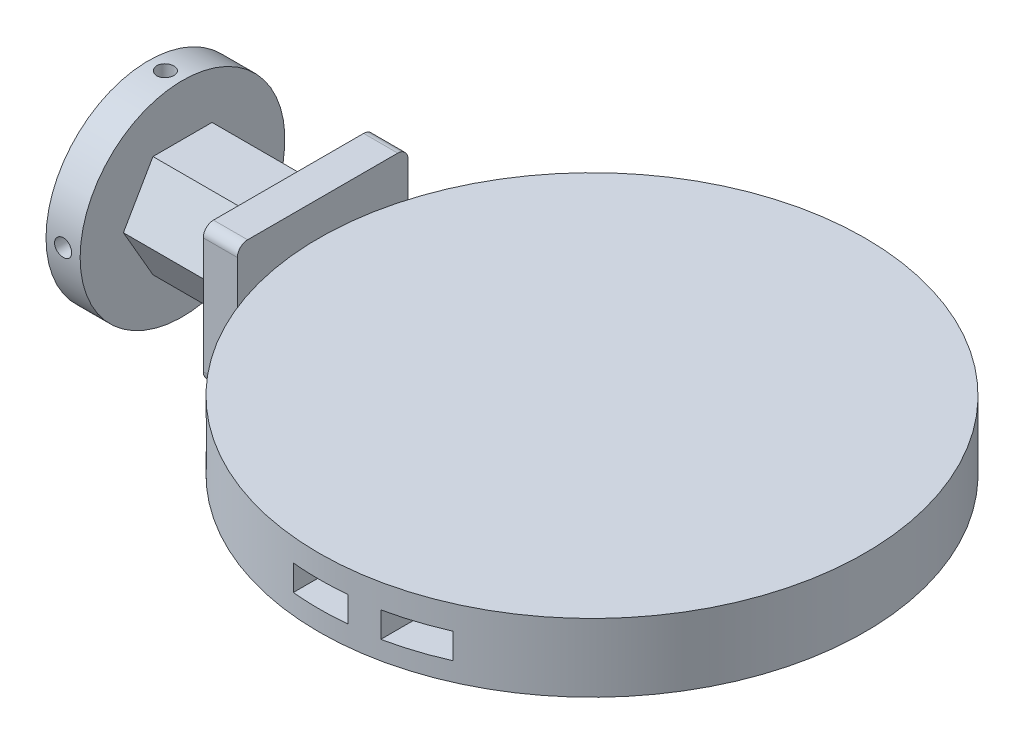
from build123d import *

# Parameters (mm, degrees)
SKETCH2_R               = 203.2
BOSS_EXTRUDE1_DEPTH     = 50.8
SKETCH6_W               = 127
SKETCH6_H               = 101.6
BOSS_EXTRUDE4_DEPTH     = 25.4
BOSS_EXTRUDE5_DEPTH     = 76.2
SKETCH8_R               = 76.2
BOSS_EXTRUDE6_DEPTH     = 25.4
CUT_EXTRUDE1_DEPTH      = 401.805239487
CUT_EXTRUDE1_DEPTH_BACK = 401.805239487
SKETCH9_R               = 6.35
CUT_EXTRUDE2_DEPTH      = 401.805239594
CUT_EXTRUDE2_DEPTH_BACK = 401.805239594
SKETCH10_R              = 6.35
FILLET1_R               = 7.62
FILLET2_R               = 7.62
FILLET3_R               = 7.62
FILLET4_R               = 7.62
SKETCH11_W              = 19.05
SKETCH11_H              = 33.02
CUT_EXTRUDE3_DEPTH      = 119.38
CUT_EXTRUDE4_DEPTH      = 401.805239594
CUT_EXTRUDE4_DEPTH_BACK = 401.805239594
SKETCH12_W              = 40.64
SKETCH12_H              = 19.05


with BuildPart() as part:
    # Sketch2 → Boss-Extrude1 (new body)
    with BuildSketch(Plane(origin=(0, 0, 0), x_dir=(1, 0, 0), z_dir=(0, 1, 0))):
        with Locations(Location((0, 0, 0), (0, 0, 270))):
            Circle(SKETCH2_R)
    extrude(amount=BOSS_EXTRUDE1_DEPTH)

    # Sketch11 → Cut-Extrude3 (cut)
    with BuildSketch(Plane(origin=(-203.2, 0, 0), x_dir=(0, 0, -1), z_dir=(1, 0, 0))):
        with Locations((140.335, 25.4)):
            Rectangle(SKETCH11_W, SKETCH11_H)
        with Locations((118.745, 25.4)):
            Rectangle(SKETCH11_W, SKETCH11_H)
        with Locations((97.155, 25.4)):
            Rectangle(SKETCH11_W, SKETCH11_H)
        with Locations((-118.745, 25.4)):
            Rectangle(SKETCH11_W, SKETCH11_H)
        with Locations((-97.155, 25.4)):
            Rectangle(SKETCH11_W, SKETCH11_H)
        with Locations((-140.335, 25.4)):
            Rectangle(SKETCH11_W, SKETCH11_H)
    extrude(amount=CUT_EXTRUDE3_DEPTH, mode=Mode.SUBTRACT)

    # Sketch12 → Cut-Extrude4 (cut, two sides: drawn at the far end of the back side and taken through both)
    with BuildSketch(Plane.XY.offset(-CUT_EXTRUDE4_DEPTH_BACK)):
        with Locations((0.245955967, 24.477312463)):
            Rectangle(SKETCH12_W, SKETCH12_H)
        with Locations((61.975563372, 23.455854612)):
            Rectangle(SKETCH12_W, SKETCH12_H)
    extrude(amount=CUT_EXTRUDE4_DEPTH + CUT_EXTRUDE4_DEPTH_BACK, mode=Mode.SUBTRACT)


with BuildPart() as body_2:
    # Sketch6 → Boss-Extrude4 (new body)
    with BuildSketch(Plane(origin=(-203.2, 0, 0), x_dir=(0, 0, -1), z_dir=(1, 0, 0))):
        with Locations((2.752969814, 25.4)):
            Rectangle(SKETCH6_W, SKETCH6_H)
    extrude(amount=-BOSS_EXTRUDE4_DEPTH)

    # Sketch7 → Boss-Extrude5 (add)
    with BuildSketch(Plane(origin=(-228.6, 0, 0), x_dir=(0, 0, -1), z_dir=(1, 0, 0))):
        Polygon((-43.994090512, 25.4), (-21.997045256, -12.7), (21.997045256, -12.7), (43.994090512, 25.4), (21.997045256, 63.5), (-21.997045256, 63.5), align=None)
    extrude(amount=-BOSS_EXTRUDE5_DEPTH)

    # Sketch8 → Boss-Extrude6 (add)
    with BuildSketch(Plane.ZY.offset(304.8)):
        with Locations((0, 25.4)):
            Circle(SKETCH8_R)
    extrude(amount=BOSS_EXTRUDE6_DEPTH)

    # Sketch9 → Cut-Extrude1 (cut, two sides: drawn at the far end of the back side and taken through both)
    with BuildSketch(Plane.XY.offset(-CUT_EXTRUDE1_DEPTH_BACK)):
        with Locations(Location((-317.5, 25.4, 0), (0, 0, 180))):
            Circle(SKETCH9_R)
    extrude(amount=CUT_EXTRUDE1_DEPTH + CUT_EXTRUDE1_DEPTH_BACK, mode=Mode.SUBTRACT)

    # Sketch10 → Cut-Extrude2 (cut, two sides: drawn at the far end of the back side and taken through both)
    with BuildSketch(Plane(origin=(0, 0, 0), x_dir=(1, 0, 0), z_dir=(0, 1, 0)).offset(-CUT_EXTRUDE2_DEPTH_BACK)):
        with Locations(Location((-317.5, 0, 0), (0, 0, 270))):
            Circle(SKETCH10_R)
    extrude(amount=CUT_EXTRUDE2_DEPTH + CUT_EXTRUDE2_DEPTH_BACK, mode=Mode.SUBTRACT)

    # Fillet1
    fillet1_edges = [body_2.edges().sort_by_distance(p)[0] for p in [
        (-215.9, 76.2, -66.252969814),
    ]]
    fillet(fillet1_edges, radius=FILLET1_R)

    # Fillet2
    fillet2_edges = [body_2.edges().sort_by_distance(p)[0] for p in [
        (-215.9, -25.4, -66.252969814),
    ]]
    fillet(fillet2_edges, radius=FILLET2_R)

    # Fillet3
    fillet3_edges = [body_2.edges().sort_by_distance(p)[0] for p in [
        (-215.9, -25.4, 60.747030186),
    ]]
    fillet(fillet3_edges, radius=FILLET3_R)

    # Fillet4
    fillet4_edges = [body_2.edges().sort_by_distance(p)[0] for p in [
        (-215.9, 76.2, 60.747030186),
    ]]
    fillet(fillet4_edges, radius=FILLET4_R)


solid = Compound([part.part, body_2.part])
